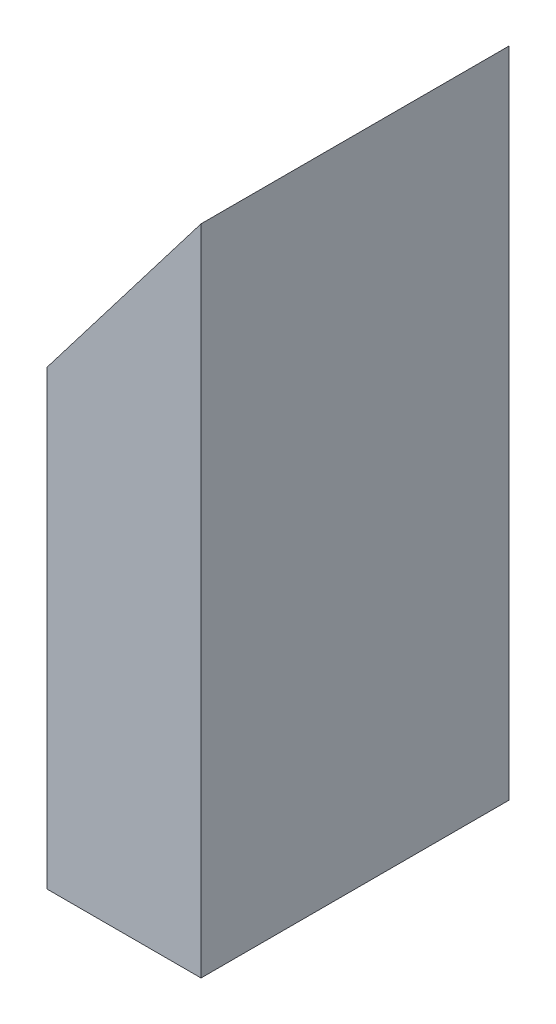
from build123d import *

# Parameters (mm, degrees)
EXTRUDE1_DEPTH                    = 25.4
F_1_4_20_TAPPED_HOLE3_D           = 5.1054
F_1_4_20_TAPPED_HOLE3_DEPTH       = 16.51
F_1_4_20_TAPPED_HOLE3_CBORE_D     = 6.35
F_1_4_20_TAPPED_HOLE3_CBORE_DEPTH = 12.7
F_1_4_20_TAPPED_HOLE3_TIP         = 1.533816902
F_10_24_TAPPED_HOLE1_D            = 3.7973
F_10_24_TAPPED_HOLE1_DEPTH        = 6.35
F_10_24_TAPPED_HOLE1_CBORE_D      = 4.826
F_10_24_TAPPED_HOLE1_CBORE_DEPTH  = 3.175
F_10_24_TAPPED_HOLE1_TIP          = 1.140824014


with BuildPart() as part:
    # Sketch1 → Extrude1 (new body)
    with BuildSketch(Plane.XY):
        Polygon((-8.815807595, 41.879239751), (-21.52120708, 25.279287896), (-21.52120708, -11.990787033), (-8.815807595, -11.990787033), align=None)
    extrude(amount=EXTRUDE1_DEPTH)

    # 1/4-20 Tapped Hole3
    with Locations(Plane(origin=(6.946606398, -11.990787033, 18.061260674), x_dir=(-1, 0, 0), z_dir=(0, -1, 0))):
        with Locations((22.117813477, 5.361260674)):
            CounterBoreHole(F_1_4_20_TAPPED_HOLE3_D / 2, F_1_4_20_TAPPED_HOLE3_CBORE_D / 2, F_1_4_20_TAPPED_HOLE3_CBORE_DEPTH, depth=F_1_4_20_TAPPED_HOLE3_DEPTH)
            with Locations((0, 0, -(F_1_4_20_TAPPED_HOLE3_DEPTH + F_1_4_20_TAPPED_HOLE3_TIP / 2))):  # 118° drill point
                Cone(0, F_1_4_20_TAPPED_HOLE3_D / 2, F_1_4_20_TAPPED_HOLE3_TIP, mode=Mode.SUBTRACT)

    # #10-24 Tapped Hole1
    with Locations(Plane(origin=(13.322416251, 70.803434574, 18.061260674), x_dir=(0.6077917109686657, 0.794096490407672, 0), z_dir=(-0.794096490407672, 0.6077917109686657, 0))):
        with Locations((-48.503844205, 5.361260674)):
            CounterBoreHole(F_10_24_TAPPED_HOLE1_D / 2, F_10_24_TAPPED_HOLE1_CBORE_D / 2, F_10_24_TAPPED_HOLE1_CBORE_DEPTH, depth=F_10_24_TAPPED_HOLE1_DEPTH)
            with Locations((0, 0, -(F_10_24_TAPPED_HOLE1_DEPTH + F_10_24_TAPPED_HOLE1_TIP / 2))):  # 118° drill point
                Cone(0, F_10_24_TAPPED_HOLE1_D / 2, F_10_24_TAPPED_HOLE1_TIP, mode=Mode.SUBTRACT)


solid = part.part
